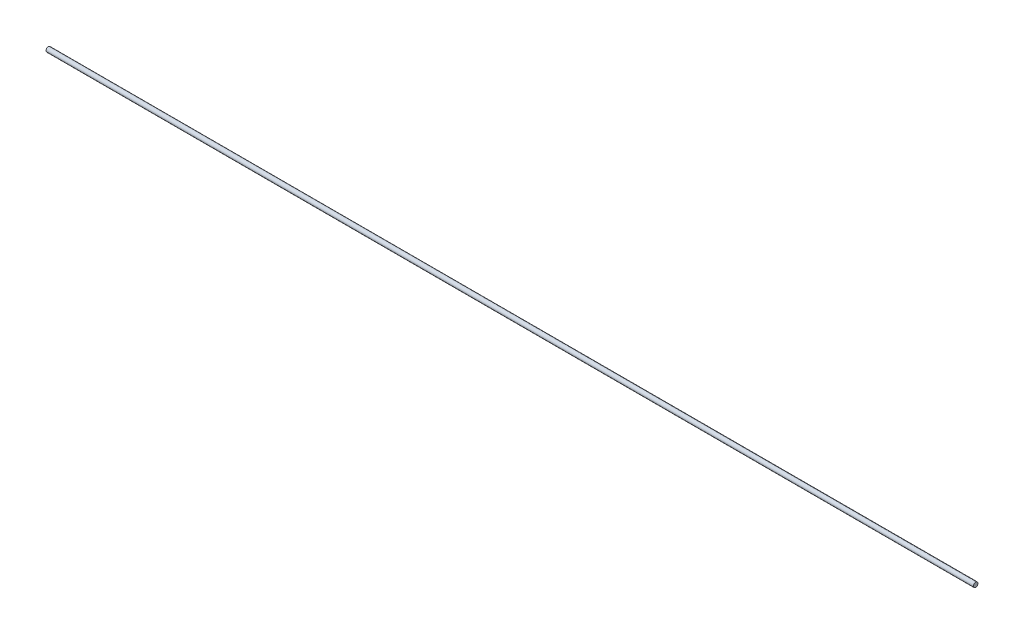
from build123d import *

# Parameters (mm, degrees)
SKETCH_1_R      = 1.5
EXTRUDE_1_DEPTH = 600


with BuildPart() as part:
    # 스케치1 → 보스-돌출1 (new body)
    with BuildSketch(Plane(origin=(0, 0, 0), x_dir=(0, 0, -1), z_dir=(1, 0, 0))):
        Circle(SKETCH_1_R)
    extrude(amount=EXTRUDE_1_DEPTH)


solid = part.part
